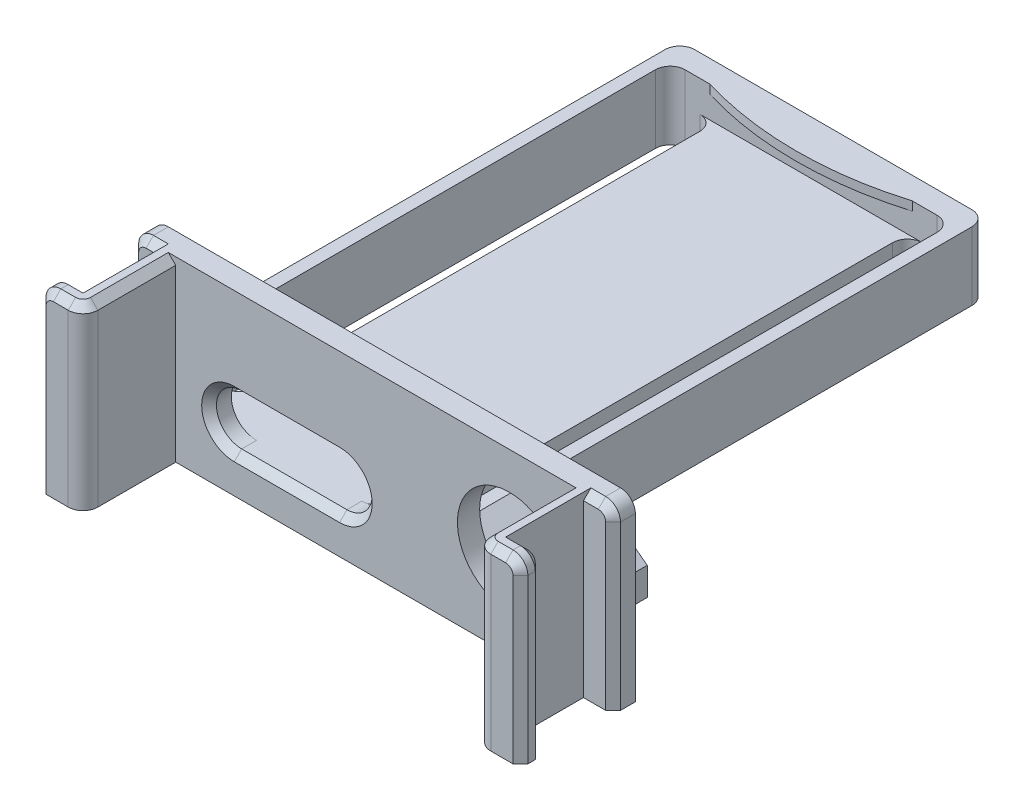
from build123d import *

# Parameters (mm, degrees)
SKETCH1_W                  = 28.5
SKETCH1_H                  = 12
BOSS_EXTRUDE1_DEPTH        = 4.75
SKETCH2_W                  = 32.5
SKETCH2_H                  = 12
BOSS_EXTRUDE2_DEPTH        = 1.5
SKETCH3_W                  = 32.5
SKETCH3_H                  = 12
BOSS_EXTRUDE3_DEPTH        = 1.5
SKETCH4_W                  = 26.5
SKETCH4_H                  = 12
CUT_EXTRUDE1_DEPTH         = 6.25
SKETCH5_R                  = 3.5
CUTOUTS_DEPTH              = 10
SKETCH6_W                  = 20.7
SKETCH6_H                  = 35.5
SKETCH6_W_2                = 3
SKETCH6_H_2                = 32
MC_TRAY_BOSS_DEPTH         = 4.6
MC_START                   = -2.1
SKETCH7_W                  = 19
SKETCH7_H                  = 34
MC_TRAY_INTERIOR_CUT_DEPTH = 2.1
SWITCH_TRIANGLE_DEPTH      = 4.5
SWITCH_TAB_DEPTH           = 2
FILLET1_R                  = 1
CHAMFER1_SIZE              = 0.5
BOSS_EXTRUDE7_DEPTH        = 0.6


with BuildPart() as part:
    # Sketch1 → Boss-Extrude1 (new body)
    with BuildSketch(Plane.XY):
        with Locations((0, 6)):
            Rectangle(SKETCH1_W, SKETCH1_H)
    extrude(amount=-BOSS_EXTRUDE1_DEPTH)

    # Sketch2 → Boss-Extrude2 (add)
    with BuildSketch(Plane.XY):
        with Locations((0, 6)):
            Rectangle(SKETCH2_W, SKETCH2_H)
    extrude(amount=BOSS_EXTRUDE2_DEPTH)

    # Sketch3 → Boss-Extrude3 (add)
    with BuildSketch(Plane(origin=(0, 0, -4.75), x_dir=(-1, 0, 0), z_dir=(0, 0, -1))):
        with Locations((0, 6)):
            Rectangle(SKETCH3_W, SKETCH3_H)
    extrude(amount=BOSS_EXTRUDE3_DEPTH)

    # Sketch4 → Cut-Extrude1 (cut)
    with BuildSketch(Plane.XY.offset(1.5)):
        with Locations((0, 6)):
            Rectangle(SKETCH4_W, SKETCH4_H)
    extrude(amount=-CUT_EXTRUDE1_DEPTH, mode=Mode.SUBTRACT)

    # Sketch5 → Cutouts (cut)
    with BuildSketch(Plane.XY.offset(-4.75)):
        with Locations((9.25, 6)):
            Circle(SKETCH5_R)
        with BuildLine():
            Line((-9.3, 5.9), (-2.2, 5.9))
            ThreePointArc((-2.2, 5.9), (-0.5, 4.2), (-2.2, 2.5))
            Line((-2.2, 2.5), (-9.3, 2.5))
            ThreePointArc((-9.3, 2.5), (-11, 4.2), (-9.3, 5.9))
        make_face()
    extrude(amount=-CUTOUTS_DEPTH, mode=Mode.SUBTRACT)

    # Sketch6 → MC Tray Boss (add)
    with BuildSketch(Plane.XZ):
        with Locations((-5.9, -24)):
            Rectangle(SKETCH6_W, SKETCH6_H)
        with Locations((-13.9, -24.25)):
            Rectangle(SKETCH6_W_2, SKETCH6_H_2, mode=Mode.SUBTRACT)
        with Locations((2.1, -24.25)):
            Rectangle(SKETCH6_W_2, SKETCH6_H_2, mode=Mode.SUBTRACT)
    extrude(amount=-MC_TRAY_BOSS_DEPTH)

    # Sketch7 → MC Tray Interior Cut (cut)
    with BuildSketch(Plane(origin=(0, 4.6, 0), x_dir=(1, 0, 0), z_dir=(0, 1, 0)).offset(MC_START)):
        with Locations((-5.9, 23.25)):
            Rectangle(SKETCH7_W, SKETCH7_H)
    extrude(amount=MC_TRAY_INTERIOR_CUT_DEPTH, mode=Mode.SUBTRACT)

    # Sketch8 → Switch Triangle (add)
    with BuildSketch(Plane(origin=(0, 0, -6.25), x_dir=(-1, 0, 0), z_dir=(0, 0, -1))):
        Polygon((-4.45, 4.6), (-4.45, 0), (-10.554406179, 0), align=None)
    extrude(amount=SWITCH_TRIANGLE_DEPTH)

    # Sketch9 → Switch Tab (add)
    with BuildSketch(Plane(origin=(0, 0, -10.75), x_dir=(-1, 0, 0), z_dir=(0, 0, -1))):
        Polygon((-4.45, 4.6), (-6.942460212, 4.6), (-10.554406179, 1.878203487), (-10.554406179, 0), (-4.45, 0), align=None)
    extrude(amount=SWITCH_TAB_DEPTH)

    # Fillet1
    fillet1_edges = [part.edges().sort_by_distance(p)[0] for p in [
        (3.6, 1.25, -8.25),
        (0.6, 1.25, -40.25),
        (0.6, 1.25, -8.25),
        (-15.4, 1.25, -8.25),
        (-12.4, 1.25, -8.25),
        (-12.4, 1.25, -40.25),
        (16.25, 12, 0.75),
        (-16.25, 12, 0.75),
        (4.45, 2.3, -12.75),
        (16.25, 12, -5.5),
        (-16.25, 12, -5.5),
        (-13.25, 6, 1.5),
        (13.25, 6, 1.5),
        (4.45, 2.3, -41.75),
        (-16.25, 2.3, -41.75),
        (-15.4, 2.3, -40.25),
        (3.6, 2.3, -40.25),
    ]]
    fillet(fillet1_edges, radius=FILLET1_R)

    # Chamfer1
    chamfer1_edges = [part.edges().sort_by_distance(p)[0] for p in [
        (13.25, 12, -2.125),
        (13.542893219, 12, 1.207106781),
        (14.75, 12, 1.5),
        (15.957106781, 11.707106781, 1.5),
        (16.25, 5.5, 1.5),
        (-13.25, 12, -2.125),
        (-13.542893219, 12, 1.207106781),
        (-14.75, 12, 1.5),
        (-15.957106781, 11.707106781, 1.5),
        (-16.25, 5.5, 1.5),
        (-14.75, 12, 0),
        (-15.957106781, 11.707106781, 0),
        (-16.25, 5.5, 0),
        (14.75, 12, 0),
        (15.957106781, 11.707106781, 0),
        (16.25, 5.5, 0),
        (14.75, 12, -4.75),
        (15.957106781, 11.707106781, -4.75),
        (16.25, 5.5, -4.75),
        (-14.75, 12, -4.75),
        (-15.957106781, 11.707106781, -4.75),
        (-16.25, 5.5, -4.75),
        (-11, 4.2, -4.75),
        (-5.75, 2.5, -4.75),
        (-5.75, 5.9, -4.75),
        (-0.5, 4.2, -4.75),
    ]]
    chamfer(chamfer1_edges, length=CHAMFER1_SIZE)

    # Sketch10 → Boss-Extrude7 (add)
    with BuildSketch(Plane(origin=(0, 4.6, 0), x_dir=(1, 0, 0), z_dir=(0, 1, 0))):
        with BuildLine():
            Line((-12.726938069, 40.25), (-5.9, 40.25))
            Line((-5.9, 40.25), (0.926938069, 40.25))
            ThreePointArc((0.926938069, 40.25), (-5.9, 39.25), (-12.726938069, 40.25))
        make_face()
    extrude(amount=-BOSS_EXTRUDE7_DEPTH)


solid = part.part
